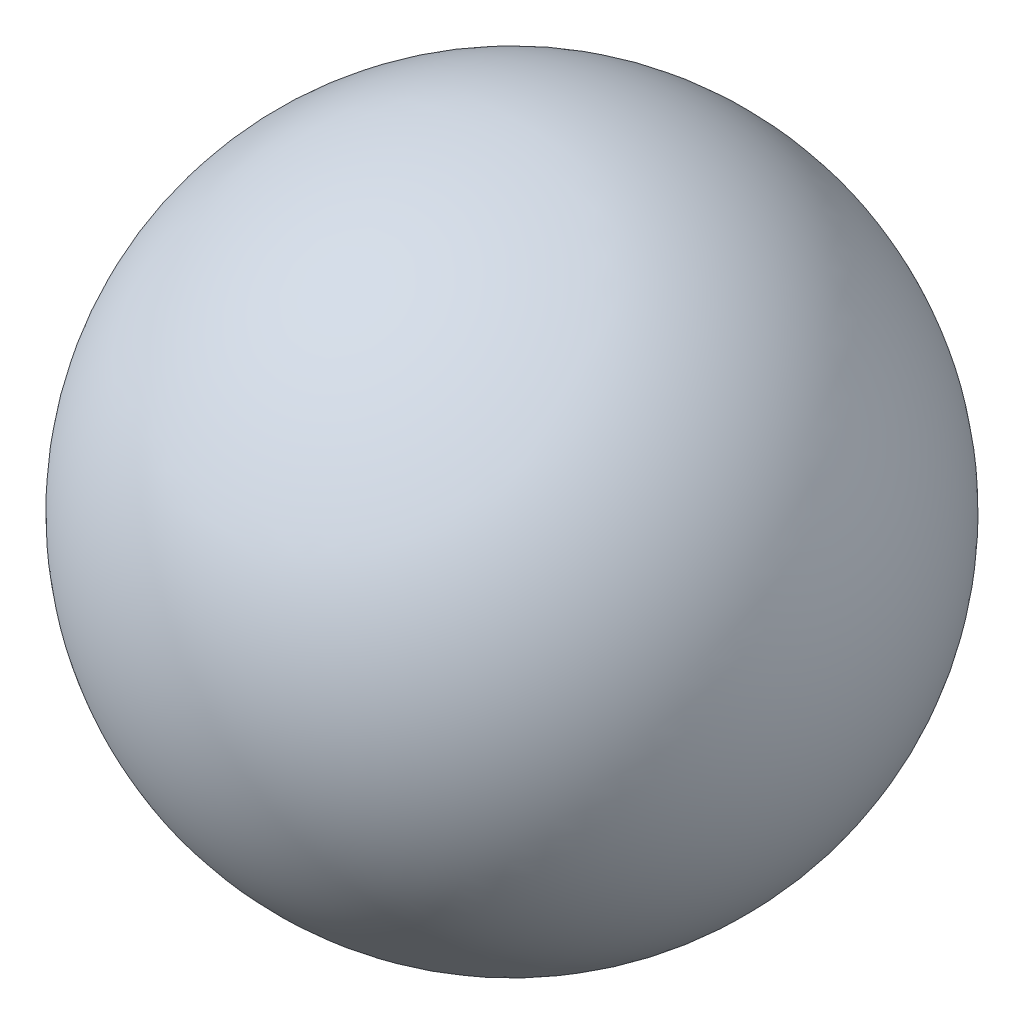
from build123d import *


with BuildPart() as part:
    # Sketch2 → Revolve1 (revolve)
    with BuildSketch(Plane(origin=(0, 0, 0), x_dir=(1, 0, 0), z_dir=(0, 1, 0))):
        with BuildLine():
            Line((0, 165.1), (0, -165.1))
            ThreePointArc((0, -165.1), (165.1, 0), (0, 165.1))
        make_face()
    revolve(axis=Axis((0, 0, -165.1), (0, 0, 1)))


solid = part.part
